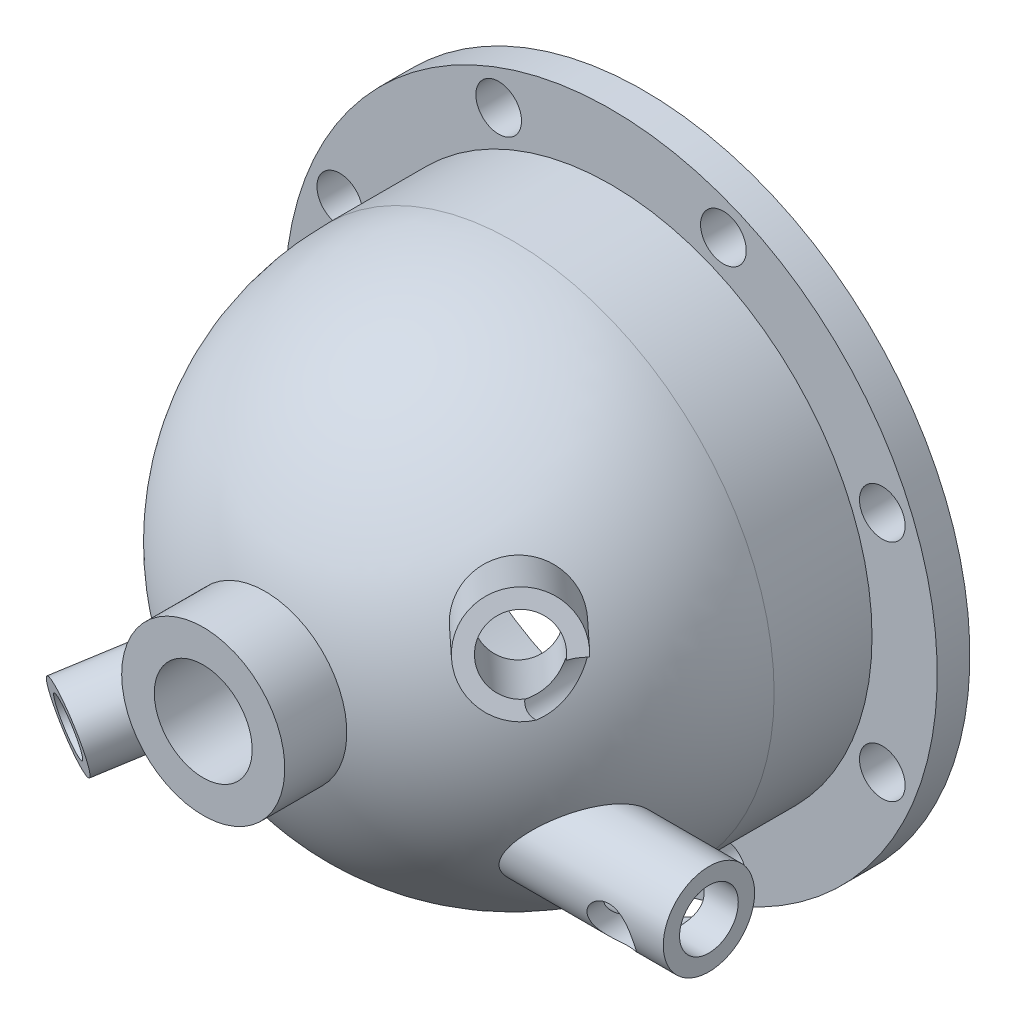
from build123d import *

# Parameters (mm, degrees)
SWEEP_2_PROFILE_R   = 15
SWEEP_4_PROFILE_R   = 12
SWEEP_8_PROFILE_R   = 14
SWEEP_2_2_PROFILE_R = 10
SWEEP_4_2_PROFILE_R = 8
SWEEP_6_PROFILE_R   = 9
SWEEP_8_2_PROFILE_R = 15
SKETCH_14_R         = 7
CUT_EXTRUDE_1_DEPTH = 197.851607437


with BuildPart() as part:
    # 草图1 → 旋转1 (revolve)
    with BuildSketch(Plane(origin=(0, 0, 0), x_dir=(1, 0, 0), z_dir=(0, 1, 0)), mode=Mode.PRIVATE) as revolve_1_sk:
        with BuildLine():
            Line((0, 40), (100, 40))
            Line((100, 40), (100, 30))
            Line((100, 30), (80, 30))
            Line((80, 30), (80, 0))
            ThreePointArc((80, 0), (64.91207586, -46.978605373), (25, -75.99))
            Line((25, -75.99), (25, -95))
            Line((25, -95), (0, -95))
            Line((0, -95), (0, 40))
        make_face()
    revolve(revolve_1_sk.sketch.rotate(Axis((0, 0, 0), (0, 0, 1)), 180), axis=Axis((0, 0, 0), (0, 0, 1)))

    # Sweep 2: sweep along a curve in space
    with BuildLine() as sweep_2_path:
        Line((0, 0, 0), (72.975534, 42.132444, 70.706637))
    # Sweep 2 profile (on start of the path) → Sweep 2 (sweep)
    with BuildSketch(Plane(origin=(0, 0, 0), x_dir=(-0.6958540466701257, 0, 0.7181832257389549), z_dir=(0.6634139477614699, 0.3830222195137217, 0.6427876113261085))):
        Circle(SWEEP_2_PROFILE_R)
    sweep(path=sweep_2_path.line)

    # Sweep 4: sweep along a curve in space
    with BuildLine() as sweep_4_path:
        Line((0, 0, 0), (-45.466334, -26.25, 90.932667))
    # Sweep 4 profile (on start of the path) → Sweep 4 (sweep)
    with BuildSketch(Plane(origin=(0, 0, 0), x_dir=(0.8944271890326863, 0, 0.4472135994344172), z_dir=(-0.4330127056430032, -0.25000000050870247, 0.8660254017621969))):
        Circle(SWEEP_4_PROFILE_R)
    sweep(path=sweep_4_path.line)

    # Sweep 8: sweep along a curve in space
    with BuildLine() as sweep_8_path:
        Line((-40, -30, 40), (100, -30, 40))
    # Sweep 8 profile (on start of the path) → Sweep 8 (sweep)
    with BuildSketch(Plane(origin=(-40, -30, 40), x_dir=(0, 0, 1), z_dir=(1, 0, 0))):
        Circle(SWEEP_8_PROFILE_R)
    sweep(path=sweep_8_path.line)

    # 草图9 → 切除-旋转1 (revolve, cut)
    with BuildSketch(Plane(origin=(0, 0, 0), x_dir=(1, 0, 0), z_dir=(0, 1, 0)), mode=Mode.PRIVATE) as cut_revolve_1_sk:
        with BuildLine():
            Line((0, 40), (72, 40))
            Line((72, 40), (72, 0))
            ThreePointArc((72, 0), (50.91, -50.91), (0, -72))
            Line((0, -72), (0, 40))
        make_face()
    revolve(cut_revolve_1_sk.sketch.rotate(Axis((0, 0, 0), (0, 0, 1)), 180), axis=Axis((0, 0, 0), (0, 0, 1)), mode=Mode.SUBTRACT)

    # Sweep 2 2: sweep along a curve in space
    with BuildLine() as sweep_2_2_path:
        Line((0, 0, 0), (74.302362, 42.898489, 71.992212))
    # Sweep 2 2 profile (on start of the path) → Sweep 2 2 (sweep, cut)
    with BuildSketch(Plane(origin=(0, 0, 0), x_dir=(-0.6958540450554378, 0, 0.7181832273034403), z_dir=(0.6634139478587641, 0.3830222240400078, 0.6427876085285833))):
        Circle(SWEEP_2_2_PROFILE_R)
    sweep(path=sweep_2_2_path.line, mode=Mode.SUBTRACT)

    # Sweep 4 2: sweep along a curve in space
    with BuildLine() as sweep_4_2_path:
        Line((0, 0, 0), (-46.332359, -26.75, 92.664718))
    # Sweep 4 2 profile (on start of the path) → Sweep 4 2 (sweep, cut)
    with BuildSketch(Plane(origin=(0, 0, 0), x_dir=(0.894427190999916, 0, 0.447213595499958), z_dir=(-0.43301270183236684, -0.2500000005183378, 0.8660254036647337))):
        Circle(SWEEP_4_2_PROFILE_R)
    sweep(path=sweep_4_2_path.line, mode=Mode.SUBTRACT)

    # 切除-扫描6: sweep along a curve in space
    with BuildLine() as sweep_6_path:
        Line((-40, -30, 40), (102, -30, 40))
    # 切除-扫描6 profile (on start of the path) → 切除-扫描6 (sweep, cut)
    with BuildSketch(Plane(origin=(-40, -30, 40), x_dir=(0, 0, 1), z_dir=(1, 0, 0))):
        Circle(SWEEP_6_PROFILE_R)
    sweep(path=sweep_6_path.line, mode=Mode.SUBTRACT)

    # Sweep 8 2: sweep along a curve in space
    with BuildLine() as sweep_8_2_path:
        Line((0, 0, 0), (0, 0, 97))
    # Sweep 8 2 profile (on start of the path) → Sweep 8 2 (sweep, cut)
    with BuildSketch(Plane.XY):
        Circle(SWEEP_8_2_PROFILE_R)
    sweep(path=sweep_8_2_path.line, mode=Mode.SUBTRACT)

    # 草图14 → 切除-拉伸1 (cut, through all)
    with BuildSketch(Plane.XY.offset(-40)):
        with Locations(Location((83.149158, 34.441509, 0), (0, 0, 180))):
            Circle(SKETCH_14_R)
        with Locations(Location((34.441509, 83.149158, 0), (0, 0, 180))):
            Circle(SKETCH_14_R)
        with Locations(Location((-34.441509, 83.149158, 0), (0, 0, 180))):
            Circle(SKETCH_14_R)
        with Locations(Location((-83.149158, 34.441509, 0), (0, 0, 180))):
            Circle(SKETCH_14_R)
        with Locations(Location((-83.149158, -34.441509, 0), (0, 0, 180))):
            Circle(SKETCH_14_R)
        with Locations(Location((-34.441509, -83.149158, 0), (0, 0, 180))):
            Circle(SKETCH_14_R)
        with Locations(Location((34.441509, -83.149158, 0), (0, 0, 180))):
            Circle(SKETCH_14_R)
        with Locations(Location((83.149158, -34.441509, 0), (0, 0, 180))):
            Circle(SKETCH_14_R)
    extrude(amount=CUT_EXTRUDE_1_DEPTH, mode=Mode.SUBTRACT)


solid = part.part
